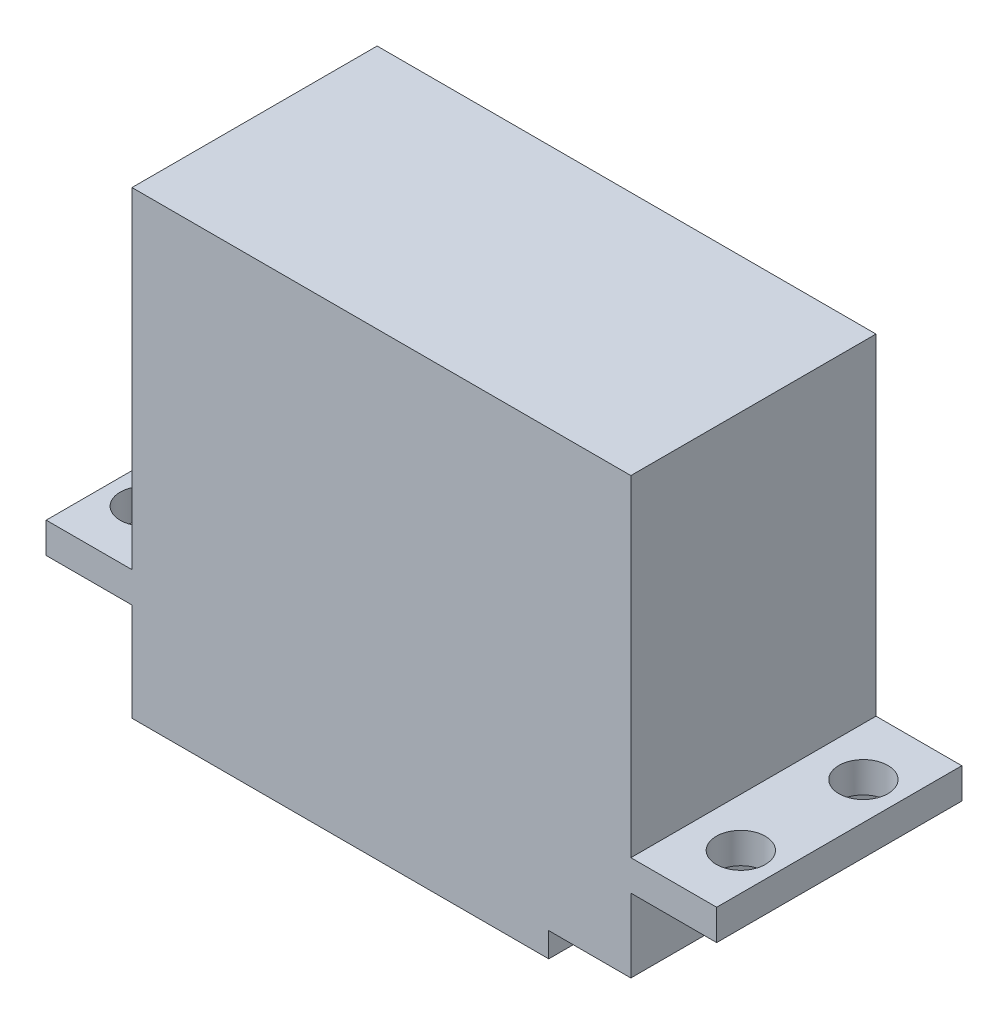
from build123d import *

# Parameters (mm, degrees)
EXTRUDE_1_DEPTH     = 20
SKETCH_4_W          = 34
SKETCH_4_H          = 20
EXTRUDE_2_DEPTH     = 2
SKETCH_5_R          = 6.5
EXTRUDE_3_DEPTH     = 1.5
SKETCH_6_R          = 2.75
EXTRUDE_4_DEPTH     = 4
SKETCH_7_R          = 2
CUT_EXTRUDE_1_DEPTH = 44.324617713


with BuildPart() as part:
    # 草图3 → 凸台-拉伸1 (new body)
    with BuildSketch(Plane.XY):
        Polygon((-20.35, 16.655405405), (20.35, 16.655405405), (20.35, -10.344594595), (27.35, -10.344594595), (27.35, -12.844594595), (20.35, -12.844594595), (20.35, -18.844594595), (-20.35, -18.844594595), (-20.35, -12.844594595), (-27.35, -12.844594595), (-27.35, -10.344594595), (-20.35, -10.344594595), align=None)
    extrude(amount=EXTRUDE_1_DEPTH)

    # 草图4 → 凸台-拉伸2 (add)
    with BuildSketch(Plane.XZ.offset(18.844594595)):
        with Locations((-3.35, 10)):
            Rectangle(SKETCH_4_W, SKETCH_4_H)
    extrude(amount=EXTRUDE_2_DEPTH)

    # 草图5 → 凸台-拉伸3 (add)
    with BuildSketch(Plane.XZ.offset(20.844594595)):
        with Locations(Location((-10.364971528, 10, 0), (0, 0, 270))):
            Circle(SKETCH_5_R)
    extrude(amount=EXTRUDE_3_DEPTH)

    # 草图6 → 凸台-拉伸4 (add)
    with BuildSketch(Plane.XZ.offset(22.344594595)):
        with Locations(Location((-10.364971528, 10, 0), (0, 0, 270))):
            Circle(SKETCH_6_R)
    extrude(amount=EXTRUDE_4_DEPTH)

    # 草图7 → 切除-拉伸1 (cut, through all)
    with BuildSketch(Plane(origin=(0, -10.344594595, 0), x_dir=(1, 0, 0), z_dir=(0, 1, 0))):
        with Locations(Location((-24.315, -4.993540971, 0), (0, 0, 270))):
            Circle(SKETCH_7_R)
        with Locations(Location((24.315, -4.993540971, 0), (0, 0, 270))):
            Circle(SKETCH_7_R)
        with Locations(Location((24.315, -14.993540971, 0), (0, 0, 270))):
            Circle(SKETCH_7_R)
        with Locations(Location((-24.315, -14.993540971, 0), (0, 0, 180))):
            Circle(SKETCH_7_R)
    extrude(amount=-CUT_EXTRUDE_1_DEPTH, mode=Mode.SUBTRACT)


solid = part.part
